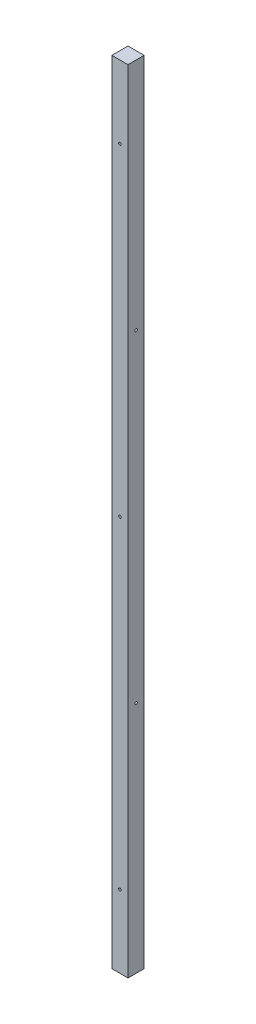
from build123d import *

# Parameters (mm, degrees)
SKETCH_1_W          = 50
SKETCH_1_H          = 50
EXTRUDE_1_DEPTH     = 2450
SKETCH_10_R         = 4
CUT_EXTRUDE_8_DEPTH = 50
SKETCH_11_R         = 4
CUT_EXTRUDE_9_DEPTH = 50


with BuildPart() as part:
    # Эскиз1 → Бобышка-Вытянуть1 (new body)
    with BuildSketch(Plane(origin=(0, 0, 0), x_dir=(1, 0, 0), z_dir=(0, 1, 0))):
        Rectangle(SKETCH_1_W, SKETCH_1_H)
    extrude(amount=EXTRUDE_1_DEPTH)

    # Эскиз10 → Вырез-Вытянуть8 (cut)
    with BuildSketch(Plane(origin=(0, 0, -25), x_dir=(-1, 0, 0), z_dir=(0, 0, -1))):
        with Locations((0, 1225)):
            Circle(SKETCH_10_R)
        with Locations((0, 2225)):
            Circle(SKETCH_10_R)
        with Locations((0, 225)):
            Circle(SKETCH_10_R)
    extrude(amount=-CUT_EXTRUDE_8_DEPTH, mode=Mode.SUBTRACT)

    # Эскиз11 → Вырез-Вытянуть9 (cut)
    with BuildSketch(Plane(origin=(25, 0, 0), x_dir=(0, 0, -1), z_dir=(1, 0, 0))):
        with Locations((0, 1725)):
            Circle(SKETCH_11_R)
        with Locations((0, 725)):
            Circle(SKETCH_11_R)
    extrude(amount=-CUT_EXTRUDE_9_DEPTH, mode=Mode.SUBTRACT)


solid = part.part
